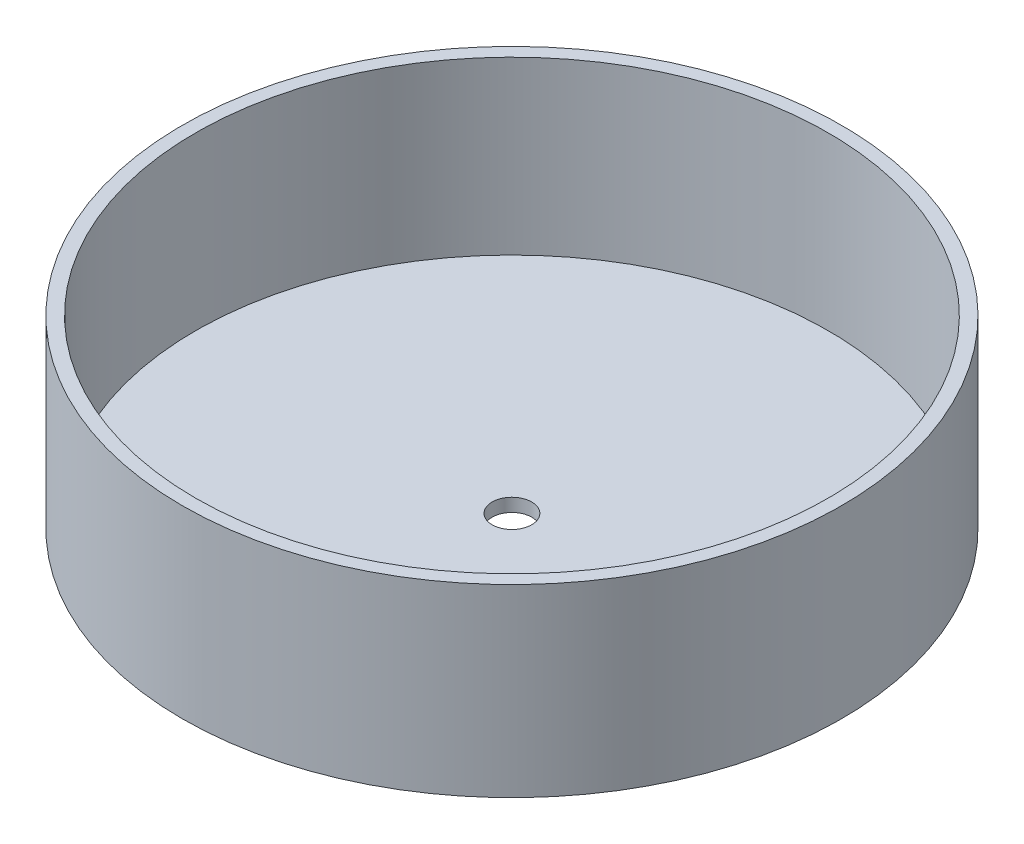
from build123d import *

# Parameters (mm, degrees)
SKETCH3_R           = 125
BOSS_EXTRUDE1_DEPTH = 35
SKETCH4_R           = 120
CUT_EXTRUDE1_DEPTH  = 65
SKETCH5_R           = 7.5
CUT_EXTRUDE2_DEPTH  = 189.348082018


with BuildPart() as part:
    # Sketch3 → Boss-Extrude1 (new, symmetric)
    with BuildSketch(Plane(origin=(0, 0, 0), x_dir=(1, 0, 0), z_dir=(0, 1, 0))):
        with Locations(Location((0, 0, 0), (0, 0, 270))):
            Circle(SKETCH3_R)
    extrude(amount=BOSS_EXTRUDE1_DEPTH, both=True)

    # Sketch4 → Cut-Extrude1 (cut)
    with BuildSketch(Plane(origin=(0, 35, 0), x_dir=(1, 0, 0), z_dir=(0, 1, 0))):
        with Locations(Location((0, 0, 0), (0, 0, 270))):
            Circle(SKETCH4_R)
    extrude(amount=-CUT_EXTRUDE1_DEPTH, mode=Mode.SUBTRACT)

    # Sketch5 → Cut-Extrude2 (cut, through all)
    with BuildSketch(Plane(origin=(0, -30, 0), x_dir=(1, 0, 0), z_dir=(0, 1, 0))):
        with Locations(Location((0, 0, 0), (0, 0, 270))):
            Circle(SKETCH5_R)
    extrude(amount=-CUT_EXTRUDE2_DEPTH, mode=Mode.SUBTRACT)


solid = part.part
